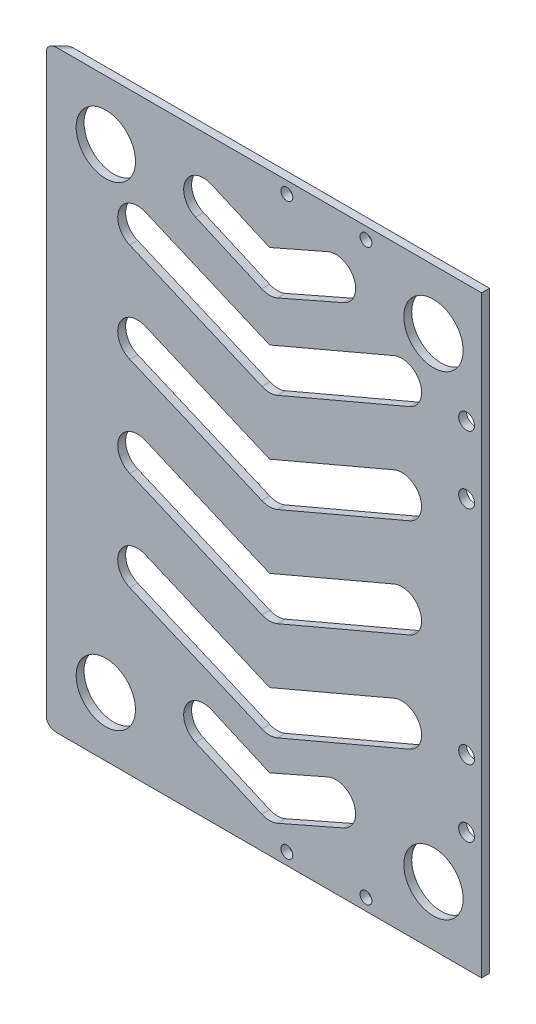
from build123d import *

# Parameters (mm, degrees)
SKETCH_1_W          = 110
SKETCH_1_H          = 150
EXTRUDE_1_DEPTH     = 2
CUT_EXTRUDE_1_DEPTH = 187.021504133
FILLET_1_R          = 2
FILLET_2_R          = 2
SKETCH_3_R          = 2
CUT_EXTRUDE_2_DEPTH = 187.021504133
SKETCH_4_R          = 1.5
CUT_EXTRUDE_3_DEPTH = 187.021504133
SKETCH_5_R          = 1.5
CUT_EXTRUDE_4_DEPTH = 187.021504133
SKETCH_6_R          = 7.5
CUT_EXTRUDE_6_DEPTH = 10
CUT_EXTRUDE_7_DEPTH = 10


with BuildPart() as part:
    # 草图1 → 凸台-拉伸1 (new body)
    with BuildSketch(Plane.XY):
        with Locations((55, 75)):
            Rectangle(SKETCH_1_W, SKETCH_1_H)
    extrude(amount=EXTRUDE_1_DEPTH)

    # 草图2 → 切除-拉伸1 (cut, through all)
    with BuildSketch(Plane(origin=(0, 150, 0), x_dir=(1, 0, 0), z_dir=(0, 1, 0))):
        Polygon((0, -2), (0, 0), (2, 0), align=None)
    extrude(amount=-CUT_EXTRUDE_1_DEPTH, mode=Mode.SUBTRACT)

    # 圆角1
    fillet_1_edges = [part.edges().sort_by_distance(p)[0] for p in [
        (1, 150, 1),
    ]]
    fillet(fillet_1_edges, radius=FILLET_1_R)

    # 圆角2
    fillet_2_edges = [part.edges().sort_by_distance(p)[0] for p in [
        (1, 0, 1),
    ]]
    fillet(fillet_2_edges, radius=FILLET_2_R)

    # 草图3 → 切除-拉伸2 (cut, through all)
    with BuildSketch(Plane.XY.offset(2)):
        with Locations((106.2, 47)):
            Circle(SKETCH_3_R)
        with Locations((106.2, 30)):
            Circle(SKETCH_3_R)
        with Locations(Location((106.2, 120, 0), (0, 0, 180))):
            Circle(SKETCH_3_R)
        with Locations(Location((106.2, 103, 0), (0, 0, 180))):
            Circle(SKETCH_3_R)
    extrude(amount=-CUT_EXTRUDE_2_DEPTH, mode=Mode.SUBTRACT)

    # 草图4 → 切除-拉伸3 (cut, through all)
    with BuildSketch(Plane(origin=(0, 0, 0), x_dir=(-1, 0, 0), z_dir=(0, 0, -1))):
        with Locations((-60.760859098, 147)):
            Circle(SKETCH_4_R)
        with Locations((-80.760859098, 147)):
            Circle(SKETCH_4_R)
    extrude(amount=-CUT_EXTRUDE_3_DEPTH, mode=Mode.SUBTRACT)

    # 草图5 → 切除-拉伸4 (cut, through all)
    with BuildSketch(Plane(origin=(0, 0, 0), x_dir=(-1, 0, 0), z_dir=(0, 0, -1))):
        with Locations((-80.76127274, 3)):
            Circle(SKETCH_5_R)
        with Locations((-60.76127274, 3)):
            Circle(SKETCH_5_R)
    extrude(amount=-CUT_EXTRUDE_4_DEPTH, mode=Mode.SUBTRACT)

    # 草图6 → 切除-拉伸6 (cut)
    with BuildSketch(Plane.XY.offset(2)):
        with Locations((15, 135)):
            Circle(SKETCH_6_R)
        with Locations(Location((15, 15, 0), (0, 0, 180))):
            Circle(SKETCH_6_R)
        with Locations((97.828427125, 15)):
            Circle(SKETCH_6_R)
        with Locations(Location((97.828427125, 135, 0), (0, 0, 180))):
            Circle(SKETCH_6_R)
    extrude(amount=-CUT_EXTRUDE_6_DEPTH, mode=Mode.SUBTRACT)

    # 草图7 → 切除-拉伸7 (cut)
    with BuildSketch(Plane.XY.offset(2)):
        with BuildLine():
            Line((56.414213562, 133.123376127), (41.691712888, 139.579112703))
            ThreePointArc((41.691712888, 139.579112703), (35.104684138, 137.007916048), (37.675880793, 130.420887297))
            Line((37.675880793, 130.420887297), (54.406297515, 123.08469044))
            ThreePointArc((54.406297515, 123.08469044), (51.414213562, 127.663803143), (54.406297515, 132.242915846))
            Line((54.406297515, 132.242915846), (56.414213562, 133.123376127))
        make_face()
        with BuildLine():
            Line((58.42212961, 132.242915846), (56.414213562, 133.123376127))
            Line((56.414213562, 133.123376127), (54.406297515, 132.242915846))
            ThreePointArc((54.406297515, 132.242915846), (51.414213562, 127.663803143), (54.406297515, 123.08469044))
            ThreePointArc((54.406297515, 123.08469044), (56.414213562, 122.663803143), (58.42212961, 123.08469044))
            ThreePointArc((58.42212961, 123.08469044), (61.414213562, 127.663803143), (58.42212961, 132.242915846))
        make_face()
        with BuildLine():
            Line((71.136714237, 139.579112703), (56.414213562, 133.123376127))
            Line((56.414213562, 133.123376127), (58.42212961, 132.242915846))
            ThreePointArc((58.42212961, 132.242915846), (61.414213562, 127.663803143), (58.42212961, 123.08469044))
            Line((58.42212961, 123.08469044), (75.152546332, 130.420887297))
            ThreePointArc((75.152546332, 130.420887297), (77.723742987, 137.007916048), (71.136714237, 139.579112703))
        make_face()
        with BuildLine():
            Line((87.859311366, 125.180806839), (56.414213562, 111.787459321))
            Line((56.414213562, 111.787459321), (58.373531952, 110.952930765))
            ThreePointArc((58.373531952, 110.952930765), (61.414213562, 106.352814304), (58.373531952, 101.752697844))
            Line((58.373531952, 101.752697844), (91.777948145, 115.980573918))
            ThreePointArc((91.777948145, 115.980573918), (94.418746216, 122.540008767), (87.859311366, 125.180806839))
        make_face()
        with BuildLine():
            Line((58.373531952, 110.952930765), (56.414213562, 111.787459321))
            Line((56.414213562, 111.787459321), (54.454895173, 110.952930765))
            ThreePointArc((54.454895173, 110.952930765), (51.414213562, 106.352814304), (54.454895173, 101.752697844))
            ThreePointArc((54.454895173, 101.752697844), (56.414213562, 101.352814304), (58.373531952, 101.752697844))
            ThreePointArc((58.373531952, 101.752697844), (61.414213562, 106.352814304), (58.373531952, 110.952930765))
        make_face()
        with BuildLine():
            Line((56.414213562, 111.787459321), (24.969115758, 125.180806839))
            ThreePointArc((24.969115758, 125.180806839), (18.409680909, 122.540008767), (21.05047898, 115.980573918))
            Line((21.05047898, 115.980573918), (54.454895173, 101.752697844))
            ThreePointArc((54.454895173, 101.752697844), (51.414213562, 106.352814304), (54.454895173, 110.952930765))
            Line((54.454895173, 110.952930765), (56.414213562, 111.787459321))
        make_face()
        with BuildLine():
            ThreePointArc((24.969115758, 100.180806839), (18.409680909, 97.540008767), (21.05047898, 90.980573918))
            Line((21.05047898, 90.980573918), (54.454895173, 76.752697844))
            ThreePointArc((54.454895173, 76.752697844), (51.414213562, 81.352814304), (54.454895173, 85.952930765))
            Line((54.454895173, 85.952930765), (56.414213562, 86.787459321))
            Line((56.414213562, 86.787459321), (24.969115758, 100.180806839))
        make_face()
        with BuildLine():
            ThreePointArc((54.454895173, 85.952930765), (51.414213562, 81.352814304), (54.454895173, 76.752697844))
            ThreePointArc((54.454895173, 76.752697844), (56.414213562, 76.352814304), (58.373531952, 76.752697844))
            ThreePointArc((58.373531952, 76.752697844), (61.414213562, 81.352814304), (58.373531952, 85.952930765))
            Line((58.373531952, 85.952930765), (56.414213562, 86.787459321))
            Line((56.414213562, 86.787459321), (54.454895173, 85.952930765))
        make_face()
        with BuildLine():
            ThreePointArc((58.373531952, 85.952930765), (61.414213562, 81.352814304), (58.373531952, 76.752697844))
            Line((58.373531952, 76.752697844), (91.777948145, 90.980573918))
            ThreePointArc((91.777948145, 90.980573918), (94.418746216, 97.540008767), (87.859311366, 100.180806839))
            Line((87.859311366, 100.180806839), (56.414213562, 86.787459321))
            Line((56.414213562, 86.787459321), (58.373531952, 85.952930765))
        make_face()
        with BuildLine():
            ThreePointArc((58.373531952, 60.952930765), (61.414213562, 56.352814304), (58.373531952, 51.752697844))
            Line((58.373531952, 51.752697844), (91.777948145, 65.980573918))
            ThreePointArc((91.777948145, 65.980573918), (94.418746216, 72.540008767), (87.859311366, 75.180806839))
            Line((87.859311366, 75.180806839), (56.414213562, 61.787459321))
            Line((56.414213562, 61.787459321), (58.373531952, 60.952930765))
        make_face()
        with BuildLine():
            ThreePointArc((54.454895173, 60.952930765), (51.414213562, 56.352814304), (54.454895173, 51.752697844))
            ThreePointArc((54.454895173, 51.752697844), (56.414213562, 51.352814304), (58.373531952, 51.752697844))
            ThreePointArc((58.373531952, 51.752697844), (61.414213562, 56.352814304), (58.373531952, 60.952930765))
            Line((58.373531952, 60.952930765), (56.414213562, 61.787459321))
            Line((56.414213562, 61.787459321), (54.454895173, 60.952930765))
        make_face()
        with BuildLine():
            ThreePointArc((24.969115758, 75.180806839), (18.409680909, 72.540008767), (21.05047898, 65.980573918))
            Line((21.05047898, 65.980573918), (54.454895173, 51.752697844))
            ThreePointArc((54.454895173, 51.752697844), (51.414213562, 56.352814304), (54.454895173, 60.952930765))
            Line((54.454895173, 60.952930765), (56.414213562, 61.787459321))
            Line((56.414213562, 61.787459321), (24.969115758, 75.180806839))
        make_face()
        with BuildLine():
            ThreePointArc((24.969115758, 50.180806839), (18.409680909, 47.540008767), (21.05047898, 40.980573918))
            Line((21.05047898, 40.980573918), (54.454895173, 26.752697844))
            ThreePointArc((54.454895173, 26.752697844), (51.414213562, 31.352814304), (54.454895173, 35.952930765))
            Line((54.454895173, 35.952930765), (56.414213562, 36.787459321))
            Line((56.414213562, 36.787459321), (24.969115758, 50.180806839))
        make_face()
        with BuildLine():
            ThreePointArc((54.454895173, 35.952930765), (51.414213562, 31.352814304), (54.454895173, 26.752697844))
            ThreePointArc((54.454895173, 26.752697844), (56.414213562, 26.352814304), (58.373531952, 26.752697844))
            ThreePointArc((58.373531952, 26.752697844), (61.414213562, 31.352814304), (58.373531952, 35.952930765))
            Line((58.373531952, 35.952930765), (56.414213562, 36.787459321))
            Line((56.414213562, 36.787459321), (54.454895173, 35.952930765))
        make_face()
        with BuildLine():
            ThreePointArc((58.373531952, 35.952930765), (61.414213562, 31.352814304), (58.373531952, 26.752697844))
            Line((58.373531952, 26.752697844), (91.777948145, 40.980573918))
            ThreePointArc((91.777948145, 40.980573918), (94.418746216, 47.540008767), (87.859311366, 50.180806839))
            Line((87.859311366, 50.180806839), (56.414213562, 36.787459321))
            Line((56.414213562, 36.787459321), (58.373531952, 35.952930765))
        make_face()
        with BuildLine():
            ThreePointArc((58.42212961, 17.242915846), (61.414213562, 12.663803143), (58.42212961, 8.08469044))
            Line((58.42212961, 8.08469044), (75.152546332, 15.420887297))
            ThreePointArc((75.152546332, 15.420887297), (77.723742987, 22.007916048), (71.136714237, 24.579112703))
            Line((71.136714237, 24.579112703), (56.414213562, 18.123376127))
            Line((56.414213562, 18.123376127), (58.42212961, 17.242915846))
        make_face()
        with BuildLine():
            ThreePointArc((54.406297515, 17.242915846), (51.414213562, 12.663803143), (54.406297515, 8.08469044))
            ThreePointArc((54.406297515, 8.08469044), (56.414213562, 7.663803143), (58.42212961, 8.08469044))
            ThreePointArc((58.42212961, 8.08469044), (61.414213562, 12.663803143), (58.42212961, 17.242915846))
            Line((58.42212961, 17.242915846), (56.414213562, 18.123376127))
            Line((56.414213562, 18.123376127), (54.406297515, 17.242915846))
        make_face()
        with BuildLine():
            ThreePointArc((41.691712888, 24.579112703), (35.104684138, 22.007916048), (37.675880793, 15.420887297))
            Line((37.675880793, 15.420887297), (54.406297515, 8.08469044))
            ThreePointArc((54.406297515, 8.08469044), (51.414213562, 12.663803143), (54.406297515, 17.242915846))
            Line((54.406297515, 17.242915846), (56.414213562, 18.123376127))
            Line((56.414213562, 18.123376127), (41.691712888, 24.579112703))
        make_face()
    extrude(amount=-CUT_EXTRUDE_7_DEPTH, mode=Mode.SUBTRACT)


solid = part.part
